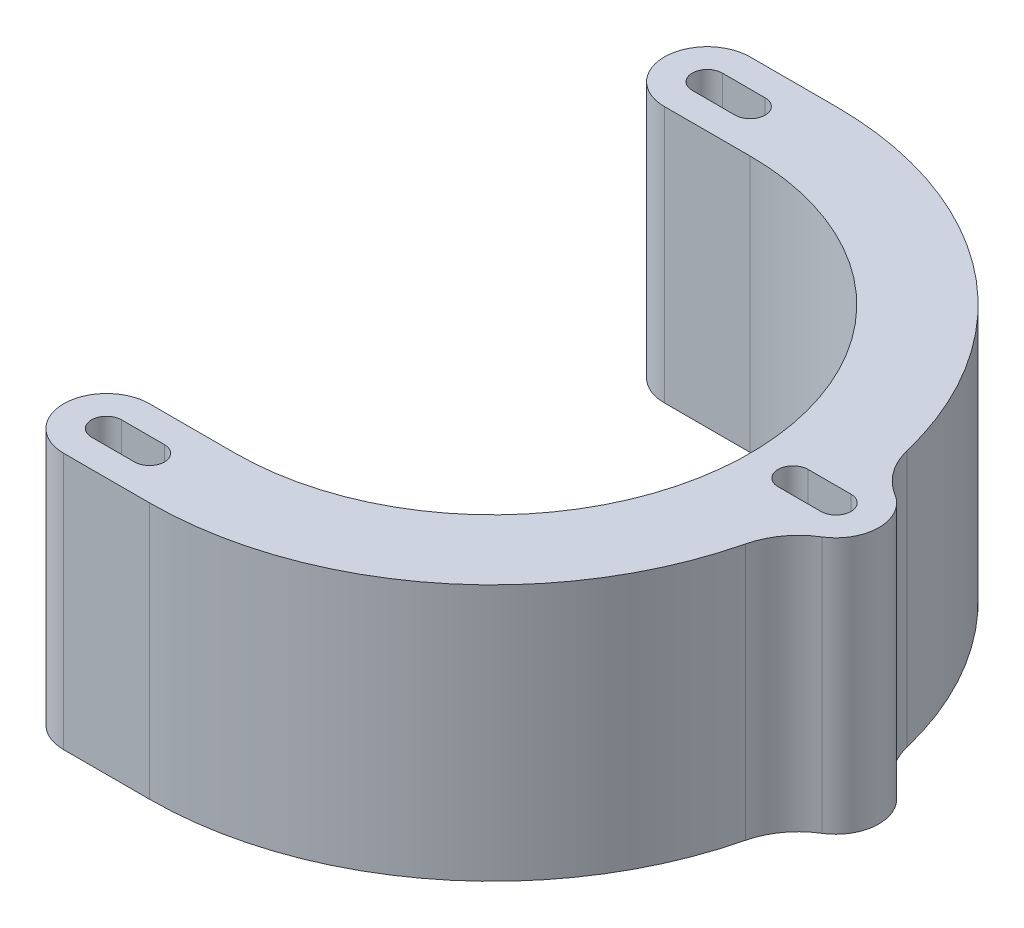
from build123d import *

# Parameters (mm, degrees)
BOSS_EXTRU_1_DEPTH      = 35.9
ESQUISSE2_R             = 1.25
ENL_V_MAT_EXTRU_1_DEPTH = 10


with BuildPart() as part:
    # Esquisse1 → Boss.-Extru.1 (new body)
    with BuildSketch(Plane(origin=(0, 0, 0), x_dir=(1, 0, 0), z_dir=(0, 1, 0))):
        with BuildLine():
            Line((-12, 48), (0, 48))
            ThreePointArc((0, 48), (29.685348475, 37.719757236), (46.655172414, 11.28250358))
            ThreePointArc((46.655172414, 11.28250358), (48.286450296, 7.752943214), (51.140625, 5.112384435))
            ThreePointArc((51.140625, 5.112384435), (54, 0), (51.140625, -5.112384435))
            ThreePointArc((51.140625, -5.112384435), (48.286450296, -7.752943214), (46.655172414, -11.28250358))
            ThreePointArc((46.655172414, -11.28250358), (29.685348475, -37.719757236), (0, -48))
            Line((0, -48), (-12, -48))
            ThreePointArc((-12, -48), (-18, -42), (-12, -36))
            Line((-12, -36), (0, -36))
            ThreePointArc((0, -36), (36, 0), (0, 36))
            Line((0, 36), (-12, 36))
            ThreePointArc((-12, 36), (-18, 42), (-12, 48))
        make_face()
        with BuildLine():
            Line((-12, 44.1), (-6, 44.1))
            ThreePointArc((-6, 44.1), (-3.9, 42), (-6, 39.9))
            Line((-6, 39.9), (-12, 39.9))
            ThreePointArc((-12, 39.9), (-14.1, 42), (-12, 44.1))
        make_face(mode=Mode.SUBTRACT)
        with BuildLine():
            Line((48, -2.1), (42, -2.1))
            ThreePointArc((42, -2.1), (39.9, 0), (42, 2.1))
            Line((42, 2.1), (48, 2.1))
            ThreePointArc((48, 2.1), (50.1, 0), (48, -2.1))
        make_face(mode=Mode.SUBTRACT)
        with BuildLine():
            Line((-12, -39.9), (-6, -39.9))
            ThreePointArc((-6, -39.9), (-3.9, -42), (-6, -44.1))
            Line((-6, -44.1), (-12, -44.1))
            ThreePointArc((-12, -44.1), (-14.1, -42), (-12, -39.9))
        make_face(mode=Mode.SUBTRACT)
    extrude(amount=BOSS_EXTRU_1_DEPTH)

    # Esquisse2 → Enlèv. mat.-Extru.1 (cut)
    with BuildSketch(Plane(origin=(0, 0, 0), x_dir=(1, 0, 0), z_dir=(0, 1, 0))):
        with Locations(Location((29.69848481, 29.69848481, 0), (0, 0, 270))):
            Circle(ESQUISSE2_R)
        with Locations(Location((29.69848481, -29.69848481, 0), (0, 0, 270))):
            Circle(ESQUISSE2_R)
    extrude(amount=ENL_V_MAT_EXTRU_1_DEPTH, mode=Mode.SUBTRACT)


solid = part.part
